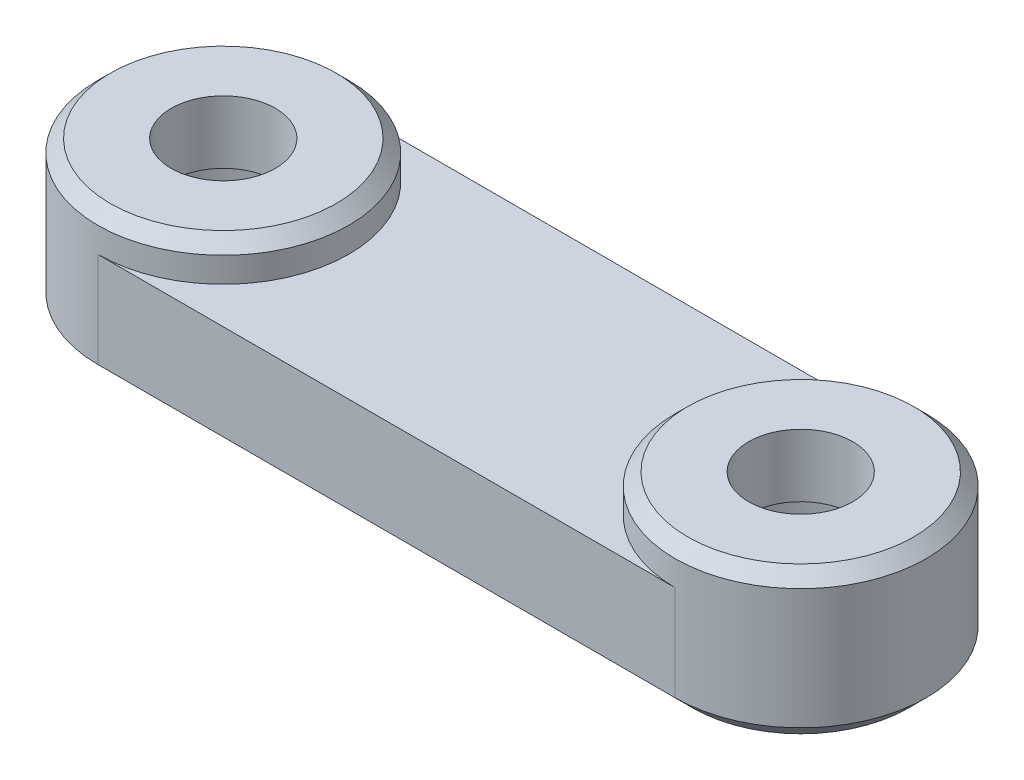
from build123d import *

# Parameters (mm, degrees)
EXTRUDE_1_DEPTH     = 6
CUT_EXTRUDE_START   = -1.5
SKETCH_4_W          = 74.791186833
SKETCH_4_H          = 47.147225829
SKETCH_4_R          = 5
CUT_EXTRUDE_1_DEPTH = 1.5
CHAMFER_1_SIZE      = 0.5
CHAMFER_2_SIZE      = 0.7


with BuildPart() as part:
    # 草图1 → 凸台-拉伸1 (new body)
    with BuildSketch(Plane(origin=(0, 0, 0), x_dir=(1, 0, 0), z_dir=(0, 1, 0))):
        with BuildLine():
            Line((0, 5), (23, 5))
            ThreePointArc((23, 5), (28, 0), (23, -5))
            Line((23, -5), (0, -5))
            ThreePointArc((0, -5), (-5, 0), (0, 5))
        make_face()
    extrude(amount=EXTRUDE_1_DEPTH)

    # 草图2 → 切除-旋转1 (revolve, cut)
    with BuildSketch(Plane.XY, mode=Mode.PRIVATE) as cut_revolve_1_sk:
        Polygon((-3.75, 0), (-3.75, 3.5), (-2.075, 3.5), (-2.075, 6), (0, 6), (0, 0), align=None)
    revolve(cut_revolve_1_sk.sketch.rotate(Axis((0, 0, 0), (0, 1, 0)), 270), axis=Axis((0, 0, 0), (0, 1, 0)), mode=Mode.SUBTRACT)

    # 草图3 → 切除-旋转2 (revolve, cut)
    with BuildSketch(Plane.XY, mode=Mode.PRIVATE) as cut_revolve_2_sk:
        Polygon((23, 0), (19.25, 0), (19.25, 3.5), (20.925, 3.5), (20.925, 6), (23, 6), align=None)
    revolve(cut_revolve_2_sk.sketch.rotate(Axis((23, 0, 0), (0, 1, 0)), 270), axis=Axis((23, 0, 0), (0, 1, 0)), mode=Mode.SUBTRACT)

    # 草图4 → 切除-拉伸1 (cut)
    with BuildSketch(Plane(origin=(0, 6, 0), x_dir=(1, 0, 0), z_dir=(0, 1, 0)).offset(CUT_EXTRUDE_START)):
        with Locations((14.679246855, 1.415799858)):
            Rectangle(SKETCH_4_W, SKETCH_4_H)
        with Locations(Location((23, 0, 0), (0, 0, 270))):
            Circle(SKETCH_4_R, mode=Mode.SUBTRACT)
        with Locations(Location((0, 0, 0), (0, 0, 270))):
            Circle(SKETCH_4_R, mode=Mode.SUBTRACT)
    extrude(amount=CUT_EXTRUDE_1_DEPTH, mode=Mode.SUBTRACT)

    # 倒角1
    chamfer_1_edges = [part.edges().sort_by_distance(p)[0] for p in [
        (23, 6, 5),
        (0, 6, -5),
    ]]
    chamfer(chamfer_1_edges, length=CHAMFER_1_SIZE)

    # 倒角2
    chamfer_2_edges = [part.edges().sort_by_distance(p)[0] for p in [
        (11.5, 0, -5),
        (28, 0, 0),
        (11.5, 0, 5),
        (-5, 0, 0),
    ]]
    chamfer(chamfer_2_edges, length=CHAMFER_2_SIZE)


solid = part.part
